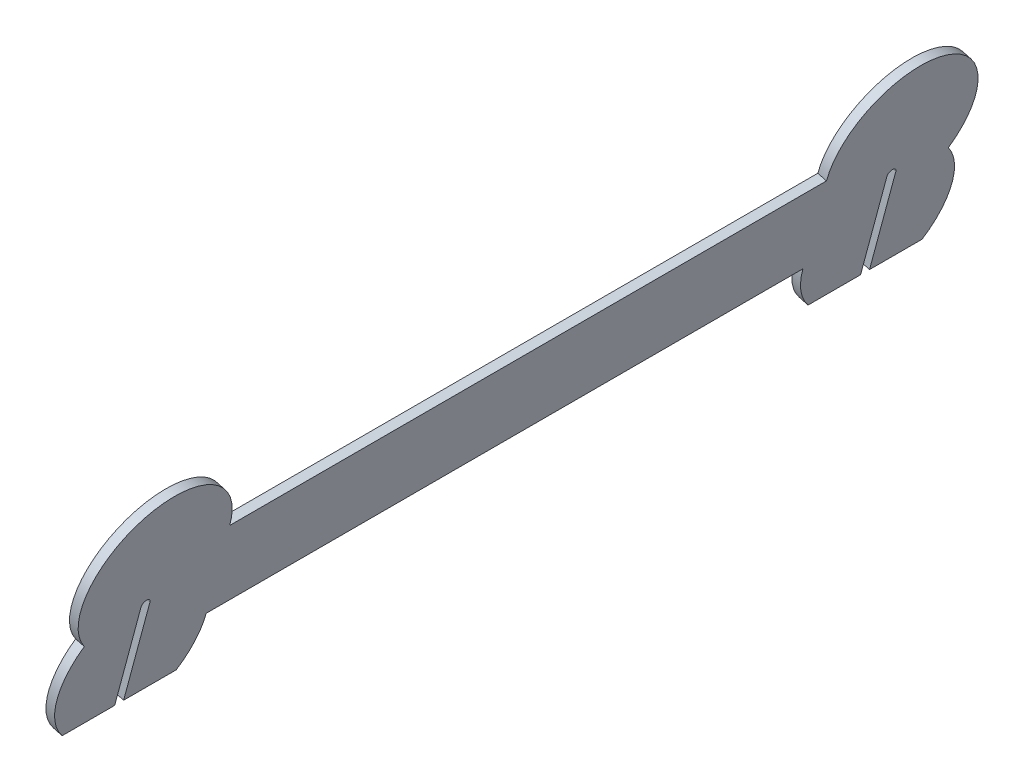
from build123d import *

# Parameters (mm, degrees)
RESSALTO_EXTRUS_O2_DEPTH = 6
RESSALTO_EXTRUS_O3_DEPTH = 6
CORTE_EXTRUS_O1_DEPTH    = 303.732253462


with BuildPart() as part:
    # Esboço1 → Ressalto-extrusão2 (new body)
    with BuildSketch(Plane.XY):
        with BuildLine():
            Line((-199.999999999, 0), (199.999999999, 0))
            ThreePointArc((199.999999999, 0), (202.565835097, -15.811388301), (209.999999999, -30))
            Line((209.999999999, -30), (289.999999999, -30))
            ThreePointArc((289.999999999, -30), (299.999014124, 0.31398499), (289.62007067, 30.5))
            ThreePointArc((289.62007067, 30.5), (297.818976076, 75.60635228), (265.815415017, 108.432822474))
            Line((265.815415017, 108.432822474), (246.403986634, 35.988385502))
            ThreePointArc((246.403986634, 35.988385502), (242.72975202, 33.867065158), (240.608431676, 37.541299773))
            Line((240.608431676, 37.541299773), (260.019860059, 109.985736744))
            ThreePointArc((260.019860059, 109.985736744), (218.38507475, 99.736242739), (199.999999999, 61))
            Line((199.999999999, 61), (140, 61))
            Line((140, 61), (150.784643454, 58.387579086))
            Line((150.784643454, 58.387579086), (139.047219324, 52.742194858))
            Line((139.047219324, 52.742194858), (160.085396074, 40.245061921))
            Line((160.085396074, 40.245061921), (137.597498913, 43.437533109))
            Line((137.597498913, 43.437533109), (153.154101004, 34.194272541))
            Line((153.154101004, 34.194272541), (138.26257587, 30.30469508))
            Line((138.26257587, 30.30469508), (144.152507453, 26))
            Line((144.152507453, 26), (149.999999999, 26))
            ThreePointArc((149.999999999, 26), (152.999999999, 23), (149.999999999, 20))
            Line((149.999999999, 20), (-149.999999999, 20))
            ThreePointArc((-149.999999999, 20), (-152.999999999, 23), (-149.999999999, 26))
            Line((-149.999999999, 26), (-144.152507453, 26))
            Line((-144.152507453, 26), (-138.26257587, 30.30469508))
            Line((-138.26257587, 30.30469508), (-153.154101004, 34.194272541))
            Line((-153.154101004, 34.194272541), (-137.597498913, 43.437533109))
            Line((-137.597498913, 43.437533109), (-160.085396074, 40.245061921))
            Line((-160.085396074, 40.245061921), (-139.047219324, 52.742194858))
            Line((-139.047219324, 52.742194858), (-150.784643454, 58.387579086))
            Line((-150.784643454, 58.387579086), (-140, 61))
            Line((-140, 61), (-199.999999999, 61))
            ThreePointArc((-199.999999999, 61), (-218.38507475, 99.736242739), (-260.019860059, 109.985736744))
            Line((-260.019860059, 109.985736744), (-240.608431676, 37.541299773))
            ThreePointArc((-240.608431676, 37.541299773), (-242.72975202, 33.867065158), (-246.403986634, 35.988385502))
            Line((-246.403986634, 35.988385502), (-265.815415017, 108.432822474))
            ThreePointArc((-265.815415017, 108.432822474), (-297.818976076, 75.60635228), (-289.62007067, 30.5))
            ThreePointArc((-289.62007067, 30.5), (-299.999014124, 0.31398499), (-289.999999999, -30))
            Line((-289.999999999, -30), (-209.999999999, -30))
            ThreePointArc((-209.999999999, -30), (-202.565835097, -15.811388301), (-199.999999999, 0))
        make_face()
    extrude(amount=RESSALTO_EXTRUS_O2_DEPTH)


with BuildPart() as body_2:
    # Esboço4 → Ressalto-extrusão3 (new body)
    with BuildSketch(Plane(origin=(215.105397993, -57.63731768, 0), x_dir=(0, 0, -1), z_dir=(0.9659258262890679, -0.25881904510252246, 0))):
        with BuildLine():
            Line((246.999999999, 62.536155533), (246.999999999, 123.536155533))
            Line((246.999999999, 123.536155533), (47, 123.536155533))
            ThreePointArc((47, 123.536155533), (32.355339059, 158.891494592), (-3, 173.536155533))
            ThreePointArc((-3, 173.536155533), (-47.860896112, 145.615557699), (-42.620070671, 93.036155533))
            ThreePointArc((-42.620070671, 93.036155533), (-52.987511897, 61.418723482), (-41.217566642, 30.296155533))
            Line((-41.217566642, 30.296155533), (35.217566642, 30.296155533))
            ThreePointArc((35.217566642, 30.296155533), (43.96210351, 45.373380875), (47, 62.536155533))
            Line((47, 62.536155533), (246.999999999, 62.536155533))
        make_face()
    extrude(amount=RESSALTO_EXTRUS_O3_DEPTH)

    # Combinar1: cut part
    add(part.part, mode=Mode.SUBTRACT)

    # Esboço6 → Corte-extrusão1 (cut, through all)
    with BuildSketch(Plane(origin=(220.900952951, -59.190231951, 0), x_dir=(0, 0, -1), z_dir=(0.9659258262890679, -0.2588190451025225, 0))):
        with BuildLine():
            Line((-6, 98.536155533), (-6, 92.597624289))
            Line((-6, 92.597624289), (0, 92.597624289))
            Line((0, 92.597624289), (0, 98.536155533))
            ThreePointArc((0, 98.536155533), (-3, 101.536155533), (-6, 98.536155533))
        make_face()
    extrude(amount=-CORTE_EXTRUS_O1_DEPTH, mode=Mode.SUBTRACT)

    # Espelhar2: body 2 across plane


with BuildPart() as body_2_1:
    add(body_2.part)
    add(body_2.part.mirror(Plane(origin=(237.086501011, 1.215055756, -246.999999999), x_dir=(1, 0, 0), z_dir=(0, 0, 1))))


solid = body_2_1.part
